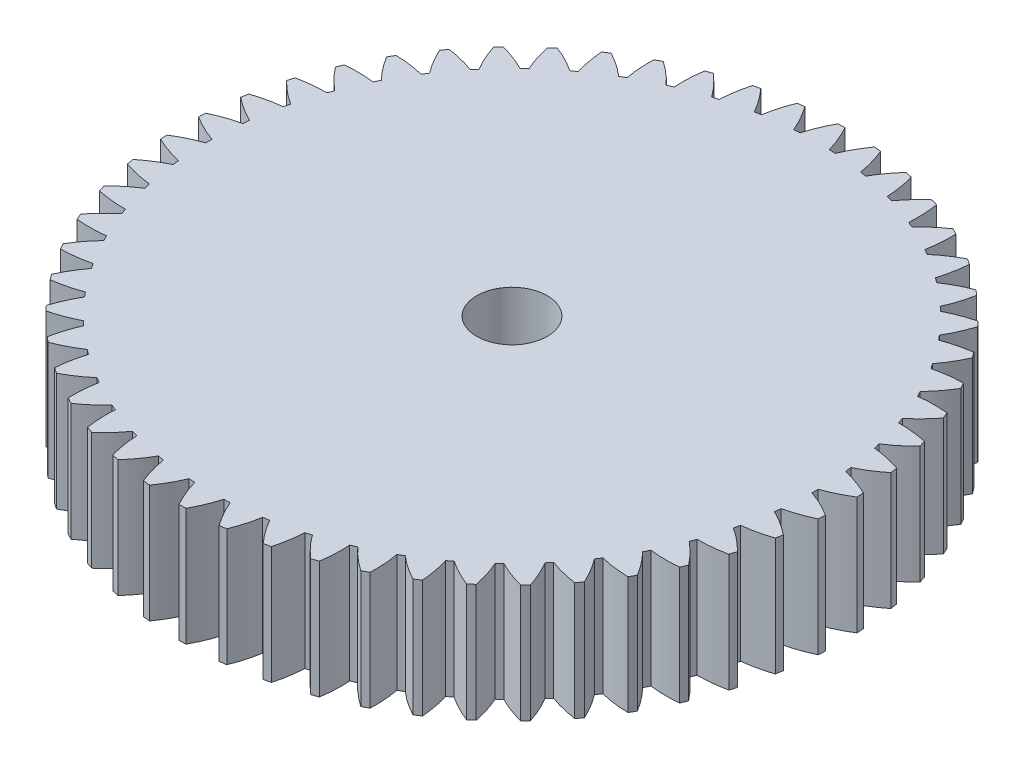
from build123d import *

# Parameters (mm, degrees)
IZIM2_R                     = 28
Y_KSEKLIK_EKSTR_ZYON1_DEPTH = 10
KES_EKSTR_ZYON3_DEPTH       = 10
DAIRESEL_KAPLAMA2_COUNT     = 54
IZIM4_R                     = 3
KES_EKSTR_ZYON4_DEPTH       = 10


with BuildPart() as part:
    # Çizim2 → Yükseklik-Ekstrüzyon1 (new body)
    with BuildSketch(Plane(origin=(0, 0, 0), x_dir=(1, 0, 0), z_dir=(0, 1, 0))):
        with Locations(Location((0, 0, 0), (0, 0, 270))):
            Circle(IZIM2_R)
    extrude(amount=Y_KSEKLIK_EKSTR_ZYON1_DEPTH)

    # Çizim3 → Kes-Ekstrüzyon3 (cut)
    with BuildSketch(Plane(origin=(0, 0, 0), x_dir=(1, 0, 0), z_dir=(0, 1, 0))):
        with BuildLine():
            ThreePointArc((26.988575858, -0.785349082), (26.997143813, -0.392716084), (27, 0))
            ThreePointArc((27, 0), (26.997143813, 0.392716084), (26.988575858, 0.785349082))
            add(Edge.make_bspline(
                [(25.748678118, 0.260912222), (25.794347071, 0.276392863), (25.893676977, 0.310943349), (26.045559068, 0.366573119), (26.25013292, 0.447465378), (26.458758468, 0.535357275), (26.668641325, 0.630021184), (26.823740108, 0.703380078), (26.930654889, 0.756244463), (26.985255479, 0.783679115), (26.988575858, 0.785349082)],
                knots=[0.31545106, 0.31545106, 0.31545106, 0.31545106, 0.31545106, 0.361767352, 0.416499661, 0.471231937, 0.525964282, 0.580696616, 0.635428982, 0.638975386, 0.638975386, 0.638975386, 0.638975386, 0.638975386], degree=4))
            ThreePointArc((25.748678118, 0.260912222), (25.749669527, 0.130457785), (25.75, 0))
            ThreePointArc((25.75, 0), (25.749669527, -0.130457785), (25.748678118, -0.260912222))
            add(Edge.make_bspline(
                [(25.748678118, -0.260912222), (25.794347071, -0.276392863), (25.893676977, -0.310943349), (26.045559068, -0.366573119), (26.25013292, -0.447465378), (26.458758468, -0.535357275), (26.668641325, -0.630021184), (26.823740108, -0.703380078), (26.930654889, -0.756244463), (26.985255479, -0.783679115), (26.988575858, -0.785349082)],
                knots=[0.31545106, 0.31545106, 0.31545106, 0.31545106, 0.31545106, 0.361767352, 0.416499661, 0.471231937, 0.525964282, 0.580696616, 0.635428982, 0.638975386, 0.638975386, 0.638975386, 0.638975386, 0.638975386], degree=4))
        make_face()
        with BuildLine():
            ThreePointArc((26.988575858, 0.785349082), (26.997143813, 0.392716084), (27, 0))
            ThreePointArc((27, 0), (26.997143813, -0.392716084), (26.988575858, -0.785349082))
            add(Edge.make_bspline(
                [(26.988575858, -0.785349082), (27.036499592, -0.809452061), (27.134719511, -0.859544153), (27.276422317, -0.933485718), (27.487560758, -1.050596012), (27.66041168, -1.148589264), (27.837908444, -1.255300859), (27.924138783, -1.308046567), (27.968140063, -1.335343179)],
                knots=[0.638975386, 0.638975386, 0.638975386, 0.638975386, 0.638975386, 0.690161387, 0.744893688, 0.799626082, 0.854358407, 0.909090914, 0.909090914, 0.909090914, 0.909090914, 0.909090914], degree=4))
            ThreePointArc((27.968140063, -1.335343179), (27.992033883, -0.667861599), (28, 0))
            ThreePointArc((28, 0), (27.992033883, 0.667861599), (27.968140063, 1.335343179))
            add(Edge.make_bspline(
                [(26.988575858, 0.785349082), (27.036499592, 0.809452061), (27.134719511, 0.859544153), (27.276422317, 0.933485718), (27.487560758, 1.050596012), (27.66041168, 1.148589264), (27.837908444, 1.255300859), (27.924138783, 1.308046567), (27.968140063, 1.335343179)],
                knots=[0.638975386, 0.638975386, 0.638975386, 0.638975386, 0.638975386, 0.690161387, 0.744893688, 0.799626082, 0.854358407, 0.909090914, 0.909090914, 0.909090914, 0.909090914, 0.909090914], degree=4))
        make_face()
    kes_ekstr_zyon3 = extrude(amount=KES_EKSTR_ZYON3_DEPTH, mode=Mode.SUBTRACT)

    # Dairesel Kaplama2: Kes-Ekstrüzyon3 ×54 about axis
    dairesel_kaplama2_axis = Axis((0, 10, 0), (0, 1, 0))
    for i in range(1, DAIRESEL_KAPLAMA2_COUNT):
        add(kes_ekstr_zyon3.rotate(dairesel_kaplama2_axis, i * 360 / DAIRESEL_KAPLAMA2_COUNT), mode=Mode.SUBTRACT)

    # Çizim4 → Kes-Ekstrüzyon4 (cut)
    with BuildSketch(Plane(origin=(0, 10, 0), x_dir=(1, 0, 0), z_dir=(0, 1, 0))):
        with Locations(Location((0, 0, 0), (0, 0, 270))):
            Circle(IZIM4_R)
    extrude(amount=-KES_EKSTR_ZYON4_DEPTH, mode=Mode.SUBTRACT)


solid = part.part
